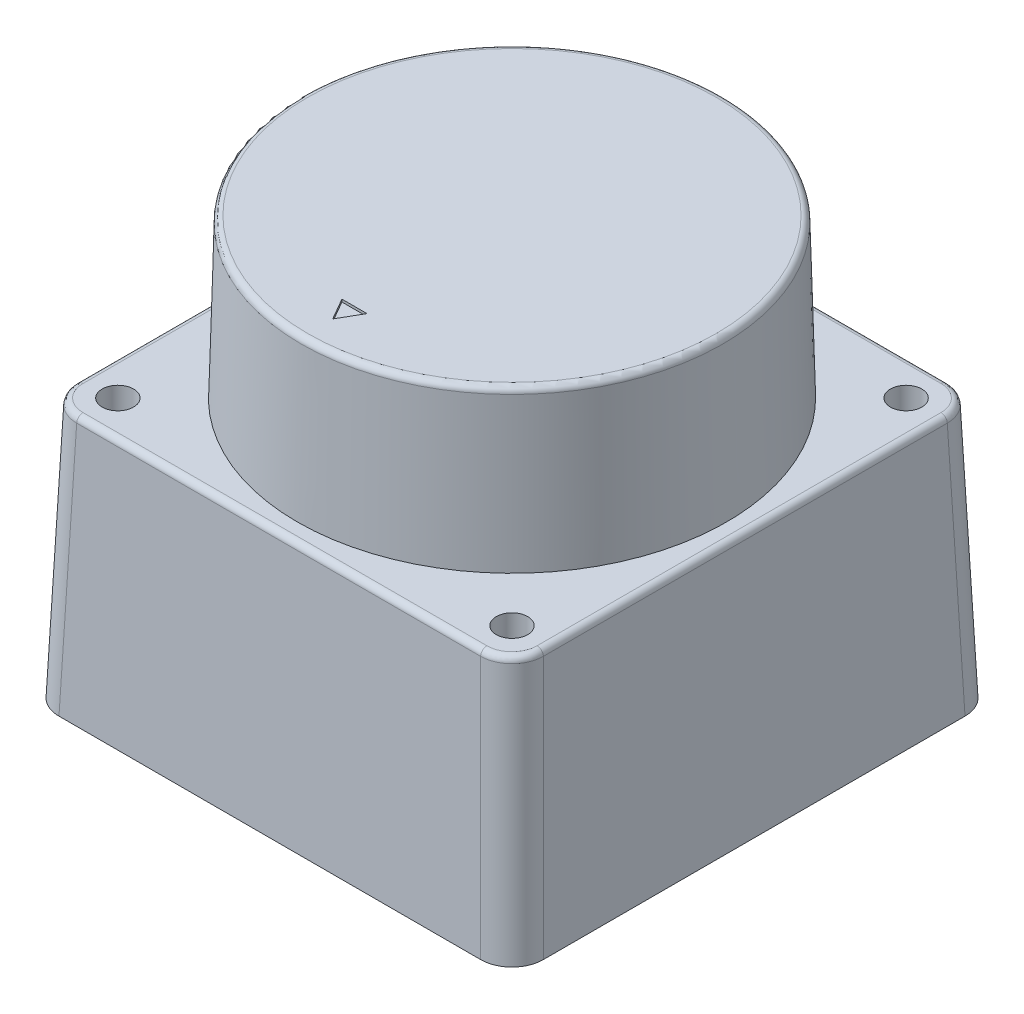
from build123d import *

# Parameters (mm, degrees)
SZKIC1_W                    = 38.59
SZKIC1_H                    = 38.59
SZKIC1_R                    = 1.25
DODANIE_WYCI_GNI_CIE1_DEPTH = 33.3
SZKIC3_OUTSIDE_W            = 53.376
SZKIC3_OUTSIDE_H            = 53.376
SZKIC3_OUTSIDE_R            = 17.645
WYTNIJ_WYCI_GNI_CIE1_DEPTH  = 12.6
POCHYLENIE2_ANGLE           = -2
POCHYLENIE3_ANGLE           = -1.5
ZAOKR_GLENIE2_R             = 2.5
ZAOKR_GLENIE3_R             = 0.5
ZAOKR_GLENIE4_R             = 0.5
WYTNIJ_WYCI_GNI_CIE2_DEPTH  = 0.2


with BuildPart() as part:
    # Szkic1 → Dodanie-wyciągnięcie1 (new body)
    with BuildSketch(Plane(origin=(0, 0, 0), x_dir=(1, 0, 0), z_dir=(0, 1, 0))):
        Rectangle(SZKIC1_W, SZKIC1_H)
        with Locations(Location((-15.7, 15.7, 0), (0, 0, 270))):
            Circle(SZKIC1_R, mode=Mode.SUBTRACT)
        with Locations(Location((15.7, 15.7, 0), (0, 0, 270))):
            Circle(SZKIC1_R, mode=Mode.SUBTRACT)
        with Locations(Location((15.7, -15.7, 0), (0, 0, 270))):
            Circle(SZKIC1_R, mode=Mode.SUBTRACT)
        with Locations(Location((-15.7, -15.7, 0), (0, 0, 270))):
            Circle(SZKIC1_R, mode=Mode.SUBTRACT)
    extrude(amount=DODANIE_WYCI_GNI_CIE1_DEPTH)

    # Szkic3 outside → Wytnij-wyciągnięcie1 (cut)
    with BuildSketch(Plane(origin=(0, 33.3, 0), x_dir=(1, 0, 0), z_dir=(0, 1, 0))):
        Rectangle(SZKIC3_OUTSIDE_W, SZKIC3_OUTSIDE_H)
        with Locations(Location((0, 0, 0), (0, 0, 270))):
            Circle(SZKIC3_OUTSIDE_R, mode=Mode.SUBTRACT)
    extrude(amount=-WYTNIJ_WYCI_GNI_CIE1_DEPTH, mode=Mode.SUBTRACT)

    # Pochylenie2
    pochylenie2_faces = [part.faces().sort_by_distance(p)[0] for p in [
        (19.295, 10.35, 0),
        (0, 10.35, 19.295),
        (-19.295, 10.35, 0),
        (0, 10.35, -19.295),
    ]]
    draft(pochylenie2_faces, Plane(origin=(0, 0, 0), x_dir=(0, 0, -1), z_dir=(0, -1, 0)), POCHYLENIE2_ANGLE)

    # Pochylenie3
    pochylenie3_faces = [part.faces().sort_by_distance(p)[0] for p in [
        (0, 27, -17.645),
    ]]
    draft(pochylenie3_faces, Plane(origin=(0, 0, 0), x_dir=(0, 0, -1), z_dir=(0, -1, 0)), POCHYLENIE3_ANGLE)

    # Zaokrąglenie2
    zaokr_glenie2_edges = [part.edges().sort_by_distance(p)[0] for p in [
        (18.933570036, 10.35, 18.933570036),
        (-18.933570036, 10.35, 18.933570036),
        (-18.933570036, 10.35, -18.933570036),
        (18.933570036, 10.35, -18.933570036),
    ]]
    fillet(zaokr_glenie2_edges, radius=ZAOKR_GLENIE2_R)

    # Zaokrąglenie3
    zaokr_glenie3_edges = [part.edges().sort_by_distance(p)[0] for p in [
        (0, 20.7, -18.572140072),
        (18.572140072, 20.7, 0),
        (-18.572140072, 20.7, 0),
        (0, 20.7, 18.572140072),
        (17.840537572, 20.7, 17.840537572),
        (-17.840537572, 20.7, 17.840537572),
        (-17.840537572, 20.7, -17.840537572),
        (17.840537572, 20.7, -17.840537572),
    ]]
    fillet(zaokr_glenie3_edges, radius=ZAOKR_GLENIE3_R)

    # Zaokrąglenie4
    zaokr_glenie4_edges = [part.edges().sort_by_distance(p)[0] for p in [
        (0, 33.3, -16.773008812),
    ]]
    fillet(zaokr_glenie4_edges, radius=ZAOKR_GLENIE4_R)

    # Szkic4 → Wytnij-wyciągnięcie2 (cut)
    with BuildSketch(Plane(origin=(0, 33.3, 0), x_dir=(1, 0, 0), z_dir=(0, 1, 0))):
        Polygon((-1, -12.549966068), (1, -12.549966068), (0, -14.282016876), align=None)
    extrude(amount=-WYTNIJ_WYCI_GNI_CIE2_DEPTH, mode=Mode.SUBTRACT)


solid = part.part
